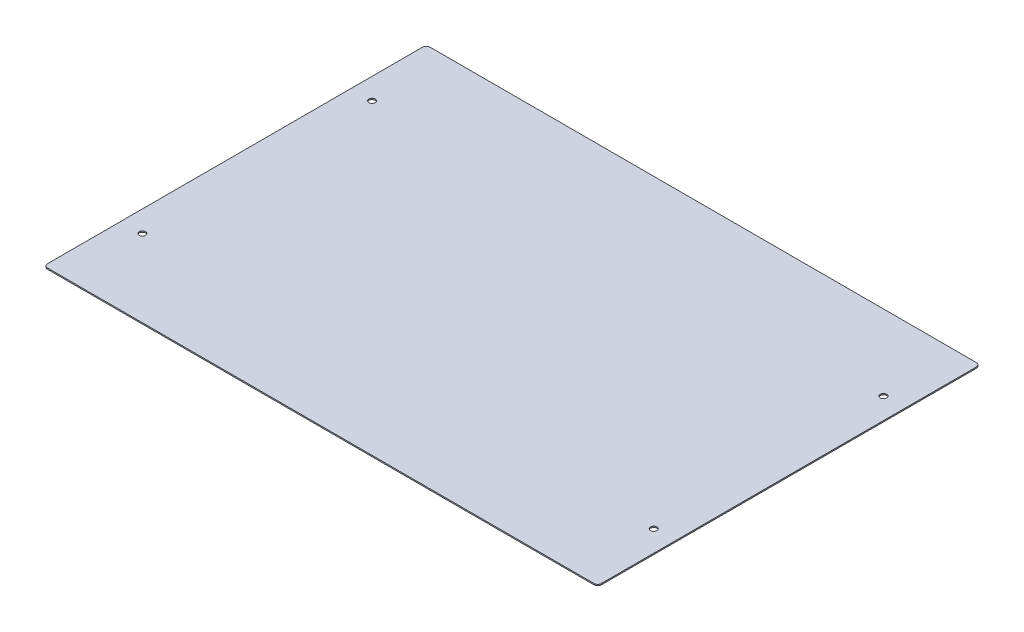
from build123d import *

# Parameters (mm, degrees)
BOSS_EXTRUDE1_DEPTH = 1
SKETCH5_R           = 2.6
CUT_EXTRUDE1_DEPTH  = 275.35173136


with BuildPart() as part:
    # Sketch1 → Boss-Extrude1 (new body)
    with BuildSketch(Plane(origin=(0, 0, 0), x_dir=(1, 0, 0), z_dir=(0, 1, 0))):
        with BuildLine():
            Line((-203.525, 155.9), (203.525, 155.9))
            Line((203.525, 155.9), (222.75, 155.9))
            ThreePointArc((222.75, 155.9), (224.871320344, 155.021320344), (225.75, 152.9))
            Line((225.75, 152.9), (225.75, 133.675))
            Line((225.75, 133.675), (225.75, -133.675))
            Line((225.75, -133.675), (225.75, -152.9))
            ThreePointArc((225.75, -152.9), (224.871320344, -155.021320344), (222.75, -155.9))
            Line((222.75, -155.9), (203.525, -155.9))
            Line((203.525, -155.9), (-203.525, -155.9))
            Line((-203.525, -155.9), (-222.75, -155.9))
            ThreePointArc((-222.75, -155.9), (-224.871320344, -155.021320344), (-225.75, -152.9))
            Line((-225.75, -152.9), (-225.75, -133.675))
            Line((-225.75, -133.675), (-225.75, 133.675))
            Line((-225.75, 133.675), (-225.75, 152.9))
            ThreePointArc((-225.75, 152.9), (-224.871320344, 155.021320344), (-222.75, 155.9))
            Line((-222.75, 155.9), (-203.525, 155.9))
        make_face()
    extrude(amount=BOSS_EXTRUDE1_DEPTH)

    # Sketch5 → Cut-Extrude1 (cut, through all)
    with BuildSketch(Plane(origin=(0, 1, 0), x_dir=(1, 0, 0), z_dir=(0, 1, 0))):
        with Locations(Location((-208.44992, 94.399, 0), (0, 0, 270))):
            Circle(SKETCH5_R)
        with Locations(Location((208.44992, 94.399, 0), (0, 0, 90))):
            Circle(SKETCH5_R)
        with Locations(Location((-208.44992, -92.899, 0), (0, 0, 270))):
            Circle(SKETCH5_R)
        with Locations(Location((208.44992, -92.899, 0), (0, 0, 270))):
            Circle(SKETCH5_R)
    extrude(amount=-CUT_EXTRUDE1_DEPTH, mode=Mode.SUBTRACT)


solid = part.part
